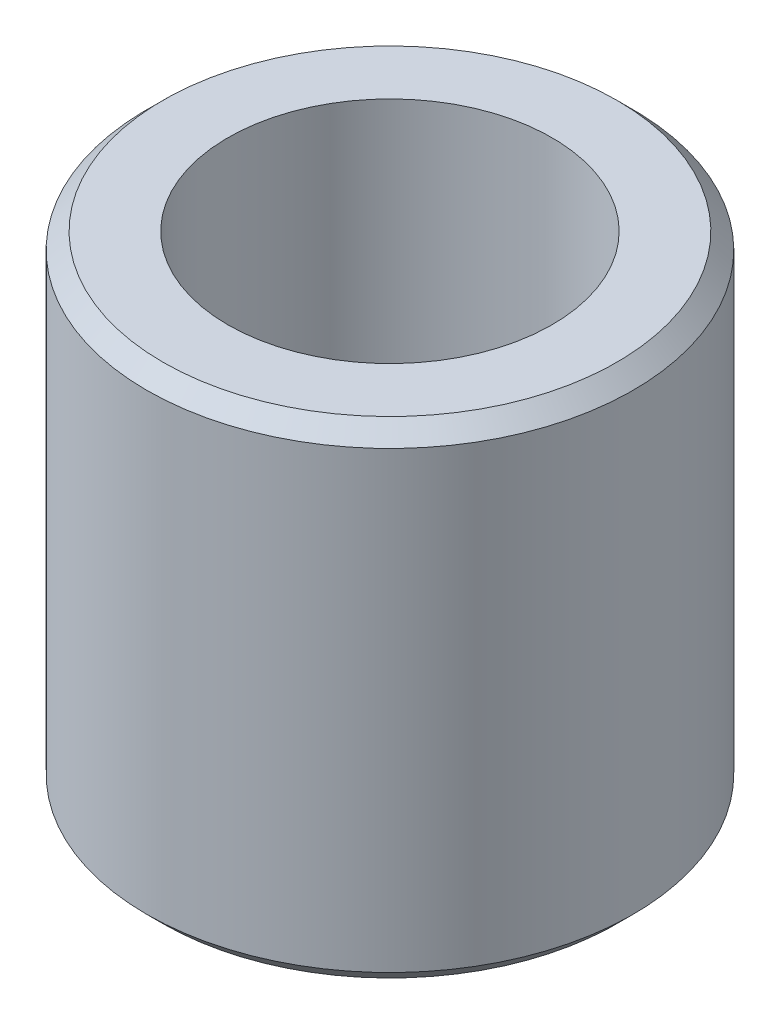
from build123d import *

# Parameters (mm, degrees)
SKETCH3_R           = 15
SKETCH3_R_2         = 10
BOSS_EXTRUDE1_DEPTH = 15
CHAMFER1_SIZE       = 1


with BuildPart() as part:
    # Sketch3 → Boss-Extrude1 (new, symmetric)
    with BuildSketch(Plane(origin=(0, 0, 0), x_dir=(1, 0, 0), z_dir=(0, 1, 0))):
        with Locations(Location((0, 0, 0), (0, 0, 270))):
            Circle(SKETCH3_R)
        with Locations(Location((0, 0, 0), (0, 0, 270))):
            Circle(SKETCH3_R_2, mode=Mode.SUBTRACT)
    extrude(amount=BOSS_EXTRUDE1_DEPTH, both=True)

    # Chamfer1
    chamfer1_edges = [part.edges().sort_by_distance(p)[0] for p in [
        (0, -15, -15),
        (0, 15, -15),
    ]]
    chamfer(chamfer1_edges, length=CHAMFER1_SIZE)


solid = part.part
